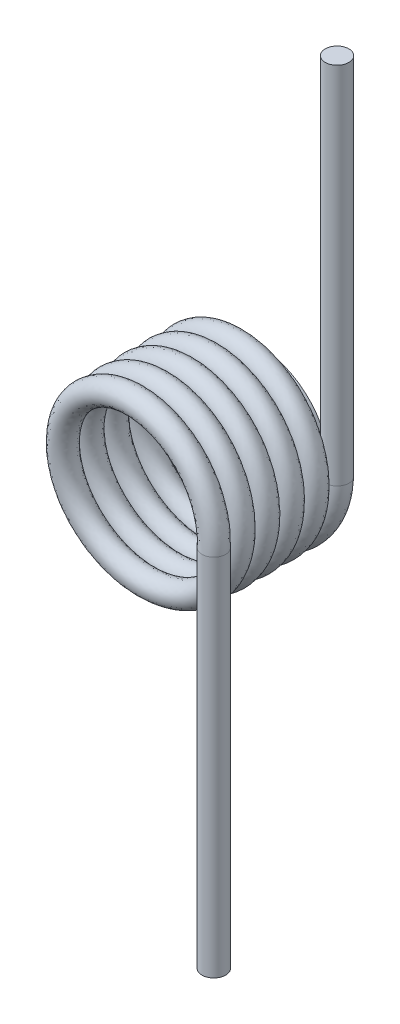
from build123d import *

# Parameters (mm, degrees)
SWEEP_9_PITCH   = 0.71
SWEEP_9_HEIGHT  = 3.55
SWEEP_9_RADIUS  = 2.35
SKETCH_6_R      = 0.34
SKETCH_7_R      = 0.34
EXTRUDE_1_DEPTH = 10.5
SKETCH_8_R      = 0.34
EXTRUDE_2_DEPTH = 10.5
SKETCH_12_W     = 0.138538984
SKETCH_12_H     = 0.144246144


with BuildPart() as part:
    # По траектории9: sweep along a helix
    with BuildLine() as sweep_9_path:
        Helix(SWEEP_9_PITCH, SWEEP_9_HEIGHT, SWEEP_9_RADIUS, center=(0, 0, 0), direction=(0, 0, 1), lefthand=True)
    # Эскиз6 → По траектории9 (sweep)
    with BuildSketch(Plane(origin=(0, 0, 0), x_dir=(1, 0, 0), z_dir=(0, 1, 0))):
        with Locations((2.35, 0)):
            Circle(SKETCH_6_R)
    sweep(path=sweep_9_path.line, is_frenet=True)

    # Эскиз7 → Вытянуть1 (add)
    with BuildSketch(Plane.XZ):
        with Locations(Location((2.35, 3.55, 0), (0, 0, 90))):
            Circle(SKETCH_7_R)
    extrude(amount=EXTRUDE_1_DEPTH)

    # Эскиз8 → Вытянуть2 (add)
    with BuildSketch(Plane(origin=(0, 0, 0), x_dir=(1, 0, 0), z_dir=(0, 1, 0))):
        with Locations(Location((2.35, 0, 0), (0, 0, 270))):
            Circle(SKETCH_8_R)
    extrude(amount=EXTRUDE_2_DEPTH)

    # По траектории12: sweep along a path in Эскиз9
    with BuildLine(Plane.XY) as sweep_12_path:
        CenterArc((0, 0), 2, 0, 360)
    # Эскиз12 → По траектории12 (sweep)
    with BuildSketch(Plane(origin=(0, 0, 0), x_dir=(1, 0, 0), z_dir=(0, 1, 0))):
        with Locations((-2, 0)):
            Rectangle(SKETCH_12_W, SKETCH_12_H)
    sweep(path=sweep_12_path.line)


solid = part.part
